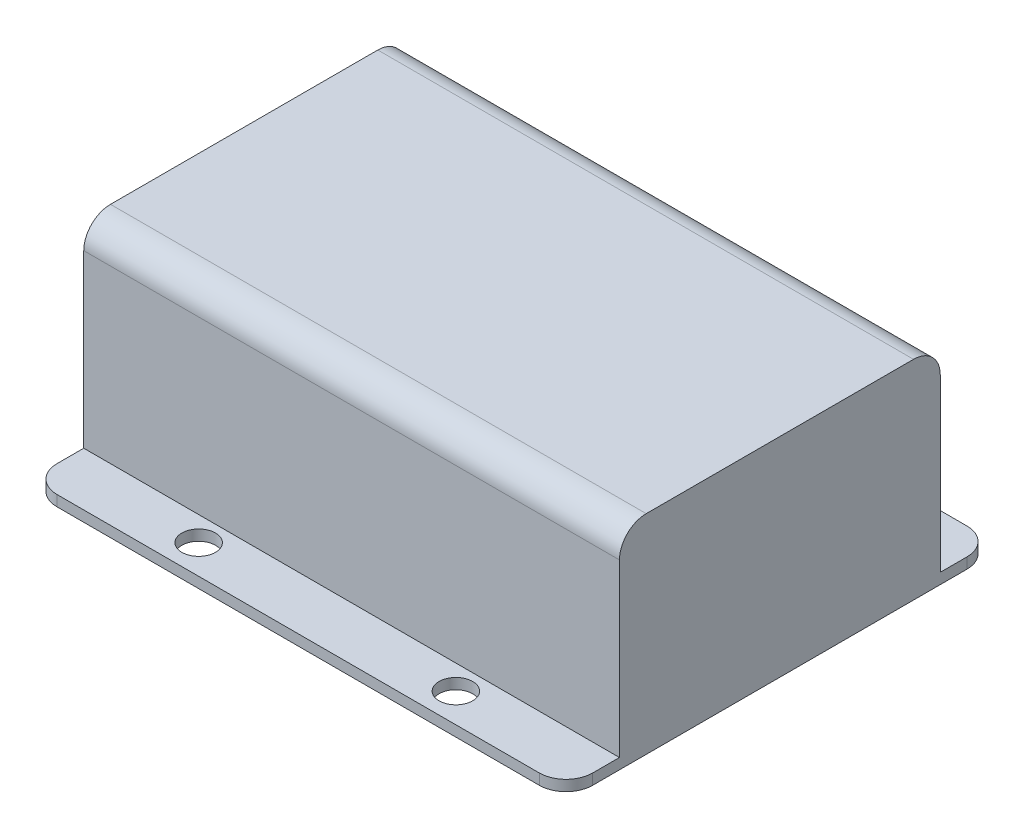
from build123d import *

# Parameters (mm, degrees)
SKETCH_1_W      = 100.2
SKETCH_1_H      = 80
SKETCH_1_R      = 3.14
EXTRUDE_1_DEPTH = 2
SKETCH_3_W      = 100.2
SKETCH_3_H      = 60
EXTRUDE_2_DEPTH = 37
FILLET_1_R      = 5
FILLET_2_R      = 5


with BuildPart() as part:
    # 草图1 → 凸台-拉伸1 (new body)
    with BuildSketch(Plane(origin=(0, 0, 0), x_dir=(1, 0, 0), z_dir=(0, 1, 0))):
        with Locations((0.09, 0)):
            Rectangle(SKETCH_1_W, SKETCH_1_H)
        with Locations(Location((-23.96, 34.55, 0), (0, 0, 270))):
            Circle(SKETCH_1_R, mode=Mode.SUBTRACT)
        with Locations(Location((24.14, 34.55, 0), (0, 0, 270))):
            Circle(SKETCH_1_R, mode=Mode.SUBTRACT)
        with Locations(Location((24.14, -34.55, 0), (0, 0, 270))):
            Circle(SKETCH_1_R, mode=Mode.SUBTRACT)
        with Locations(Location((-23.96, -34.55, 0), (0, 0, 270))):
            Circle(SKETCH_1_R, mode=Mode.SUBTRACT)
    extrude(amount=EXTRUDE_1_DEPTH)

    # 草图3 → 凸台-拉伸2 (add)
    with BuildSketch(Plane(origin=(0, 2, 0), x_dir=(1, 0, 0), z_dir=(0, 1, 0))):
        with Locations((0.09, 0)):
            Rectangle(SKETCH_3_W, SKETCH_3_H)
    extrude(amount=EXTRUDE_2_DEPTH)

    # 圆角1
    fillet_1_edges = [part.edges().sort_by_distance(p)[0] for p in [
        (-50.01, 1, -40),
        (50.19, 1, -40),
        (50.19, 1, 40),
        (-50.01, 1, 40),
    ]]
    fillet(fillet_1_edges, radius=FILLET_1_R)

    # 圆角2
    fillet_2_edges = [part.edges().sort_by_distance(p)[0] for p in [
        (0.09, 39, 30),
        (0.09, 39, -30),
    ]]
    fillet(fillet_2_edges, radius=FILLET_2_R)


solid = part.part
